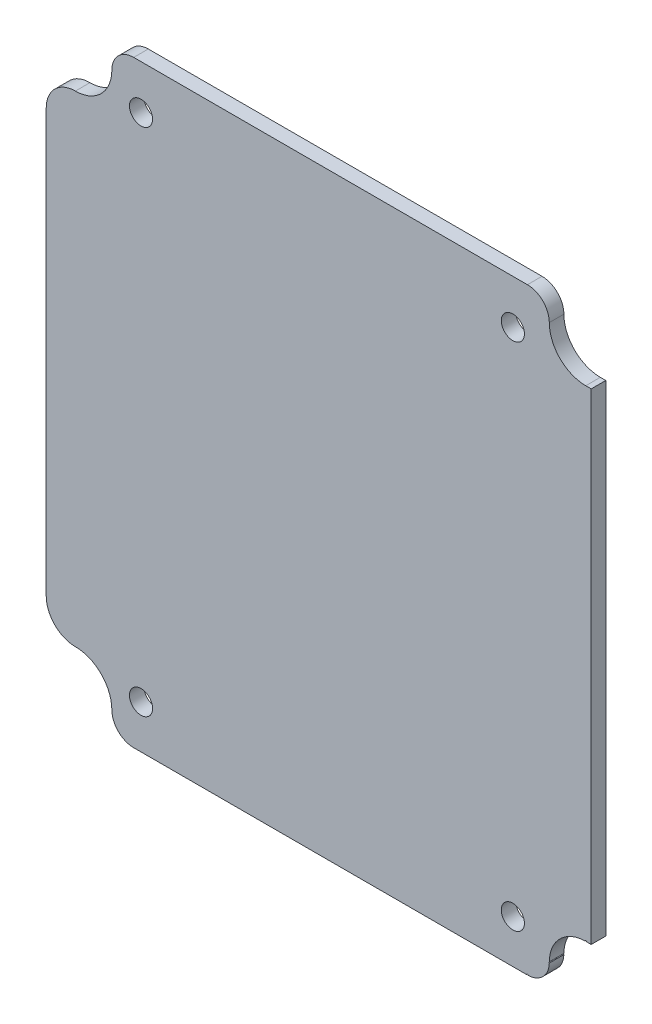
from build123d import *

# Parameters (mm, degrees)
MODEL_R             = 1.587496825
BOSS_EXTRUDE1_DEPTH = 2


with BuildPart() as part:
    # Model → Boss-Extrude1 (new body)
    with BuildSketch(Plane.XY):
        with BuildLine():
            Line((-146.653910016, 921.021419751), (-146.653491939, 987.021287754))
            Line((-146.653491939, 987.021287754), (-147.399894202, 987.021287754))
            ThreePointArc((-147.399894202, 987.021287754), (-150.935437408, 988.485719341), (-152.399999963, 992.021208297))
            ThreePointArc((-152.399999963, 992.021208297), (-153.278698205, 994.142573511), (-155.400063419, 995.021271753))
            Line((-155.400063419, 995.021271753), (-209.399816512, 995.021271753))
            ThreePointArc((-209.399816512, 995.021271753), (-211.521116241, 994.142638994), (-212.399879965, 992.021393514))
            ThreePointArc((-212.399879965, 992.021393514), (-213.864303366, 988.485858493), (-217.399777355, 987.021287754))
            ThreePointArc((-217.399777355, 987.021287754), (-220.228264308, 985.849690097), (-221.399861964, 983.021203145))
            Line((-221.399861964, 983.021203145), (-221.399861964, 925.021411752))
            ThreePointArc((-221.399861964, 925.021411752), (-220.228216634, 922.192969733), (-217.39973512, 921.02141975))
            ThreePointArc((-217.39973512, 921.02141975), (-213.864288435, 919.55683408), (-212.399879966, 916.021313993))
            ThreePointArc((-212.399879966, 916.021313993), (-211.521116244, 913.900068513), (-209.399816515, 913.021435753))
            Line((-209.399816515, 913.021435753), (-155.506885764, 913.021435753))
            ThreePointArc((-155.506885764, 913.021435753), (-155.475395221, 913.097173017), (-155.399490011, 913.128256561))
            ThreePointArc((-155.399490011, 913.128256561), (-155.324999759, 913.097438787), (-155.293258, 913.023337548))
            ThreePointArc((-155.293258, 913.023337548), (-153.267730715, 913.91115848), (-152.400955638, 915.945780743))
            ThreePointArc((-152.400955638, 915.945780743), (-152.427675956, 915.951027262), (-152.450799863, 915.965407327))
            ThreePointArc((-152.450799863, 915.965407327), (-152.470357006, 916.048810735), (-152.399429358, 916.096851124))
            ThreePointArc((-152.399429358, 916.096851124), (-150.946546283, 919.545844687), (-147.506710495, 921.020278673))
            ThreePointArc((-147.506710495, 921.020278673), (-147.476166718, 921.096209628), (-147.400849891, 921.128237863))
            ThreePointArc((-147.400849891, 921.128237863), (-147.324698014, 921.09729172), (-147.293071814, 921.021419751))
            Line((-147.293071814, 921.021419751), (-146.653910016, 921.021419751))
        make_face()
        with Locations((-208.399887964, 918.965401326)):
            Circle(MODEL_R, mode=Mode.SUBTRACT)
        with Locations((-157.399989964, 918.965401326)):
            Circle(MODEL_R, mode=Mode.SUBTRACT)
        with Locations((-208.399887964, 988.965261326)):
            Circle(MODEL_R, mode=Mode.SUBTRACT)
        with Locations((-157.399989964, 988.965261326)):
            Circle(MODEL_R, mode=Mode.SUBTRACT)
    extrude(amount=BOSS_EXTRUDE1_DEPTH)


solid = part.part
